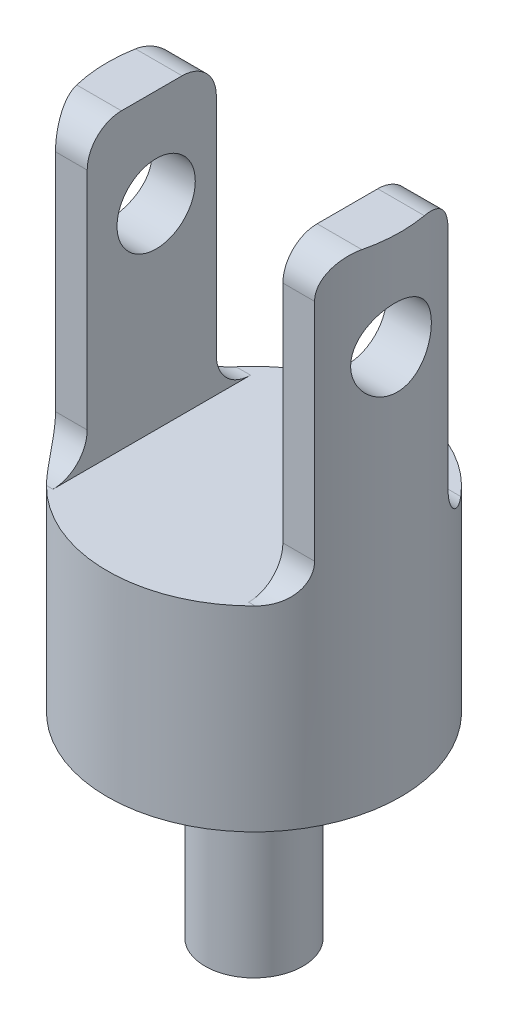
from build123d import *

# Parameters (mm, degrees)
SKETCH1_R           = 15
BOSS_EXTRUDE1_DEPTH = 50
SKETCH2_R           = 5
BOSS_EXTRUDE2_DEPTH = 20
SKETCH3_W           = 20
SKETCH3_H           = 48.158533428
CUT_EXTRUDE1_DEPTH  = 30
SKETCH4_W           = 29.182617016
SKETCH4_H           = 12.047974763
CUT_EXTRUDE4_DEPTH  = 30
SKETCH7_W           = 65.578145757
SKETCH7_H           = 22.973592685
CUT_EXTRUDE5_DEPTH  = 30
FILLET6_R           = 3.5
SKETCH9_R           = 4
CUT_EXTRUDE6_DEPTH  = 58.879184669
SKETCH11_R          = 4
CUT_EXTRUDE7_DEPTH  = 58.879184669


with BuildPart() as part:
    # Sketch1 → Boss-Extrude1 (new body)
    with BuildSketch(Plane(origin=(0, 0, 0), x_dir=(1, 0, 0), z_dir=(0, 1, 0))):
        with Locations(Location((0, 0, 0), (0, 0, 90))):
            Circle(SKETCH1_R)
    extrude(amount=BOSS_EXTRUDE1_DEPTH)

    # Sketch2 → Boss-Extrude2 (add)
    with BuildSketch(Plane.XZ):
        with Locations(Location((0, 0, 0), (0, 0, 270))):
            Circle(SKETCH2_R)
    extrude(amount=BOSS_EXTRUDE2_DEPTH)

    # Sketch3 → Cut-Extrude1 (cut)
    with BuildSketch(Plane(origin=(0, 50, 0), x_dir=(1, 0, 0), z_dir=(0, 1, 0))):
        Rectangle(SKETCH3_W, SKETCH3_H)
    extrude(amount=-CUT_EXTRUDE1_DEPTH, mode=Mode.SUBTRACT)

    # Sketch4 → Cut-Extrude4 (cut)
    with BuildSketch(Plane(origin=(0, 50, 0), x_dir=(1, 0, 0), z_dir=(0, 1, 0))):
        with Locations((0.622640913, 13.072097126)):
            Rectangle(SKETCH4_W, SKETCH4_H)
    cut_extrude4 = extrude(amount=-CUT_EXTRUDE4_DEPTH, mode=Mode.SUBTRACT)

    # Sketch7 → Cut-Extrude5 (cut)
    with BuildSketch(Plane(origin=(0, 50, 0), x_dir=(1, 0, 0), z_dir=(0, 1, 0))):
        with Locations((5.132045661, 17.636797086)):
            Rectangle(SKETCH7_W, SKETCH7_H)
    extrude(amount=-CUT_EXTRUDE5_DEPTH, mode=Mode.SUBTRACT)

    # Mirror1: Cut-Extrude4 across plane
    add(cut_extrude4.mirror(Plane.XY), mode=Mode.SUBTRACT)

    # Fillet6
    fillet6_edges = [part.edges().sort_by_distance(p)[0] for p in [
        (-11.84064125, 20, -6.150000743),
        (11.84064125, 20, -6.150000743),
        (-11.84064125, 50, -6.150000743),
        (11.84064125, 50, -6.150000743),
        (-11.620501285, 50, 7.048109744),
        (11.620501285, 50, 7.048109744),
        (-11.620501285, 20, 7.048109744),
        (11.620501285, 20, 7.048109744),
    ]]
    fillet(fillet6_edges, radius=FILLET6_R)

    # Sketch9 → Cut-Extrude6 (cut, through all)
    with BuildSketch(Plane(origin=(-10, 0, 0), x_dir=(0, 0, -1), z_dir=(1, 0, 0))):
        with Locations((0, 40)):
            Circle(SKETCH9_R)
    extrude(amount=-CUT_EXTRUDE6_DEPTH, mode=Mode.SUBTRACT)

    # Sketch11 → Cut-Extrude7 (cut, through all)
    with BuildSketch(Plane.ZY.offset(-10)):
        with Locations((0.4490545, 40)):
            Circle(SKETCH11_R)
    extrude(amount=-CUT_EXTRUDE7_DEPTH, mode=Mode.SUBTRACT)


solid = part.part
